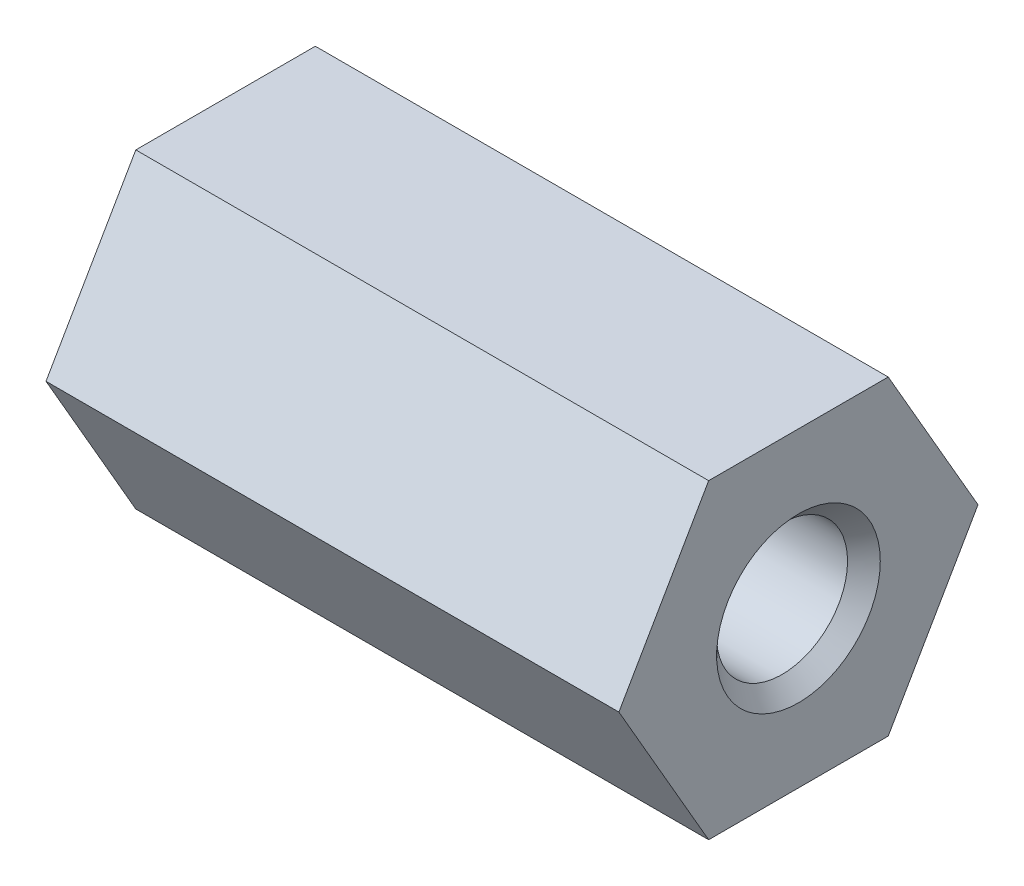
from build123d import *

# Parameters (mm, degrees)
SKETCH_2_R      = 4
EXTRUDE_1_DEPTH = 35
CHAMFER_1_SIZE  = 1


with BuildPart() as part:
    # Эскиз2 → Бобышка-Вытянуть1 (new body)
    with BuildSketch(Plane(origin=(0, 0, 0), x_dir=(0, 0, -1), z_dir=(1, 0, 0))):
        Polygon((-10.969655115, 0), (-5.484827557, 9.5), (5.484827557, 9.5), (10.969655115, 0), (5.484827557, -9.5), (-5.484827557, -9.5), align=None)
        Circle(SKETCH_2_R, mode=Mode.SUBTRACT)
    extrude(amount=EXTRUDE_1_DEPTH)

    # Фаска1
    chamfer_1_edges = [part.edges().sort_by_distance(p)[0] for p in [
        (0, 0, 4),
        (35, 0, 4),
    ]]
    chamfer(chamfer_1_edges, length=CHAMFER_1_SIZE)


solid = part.part
